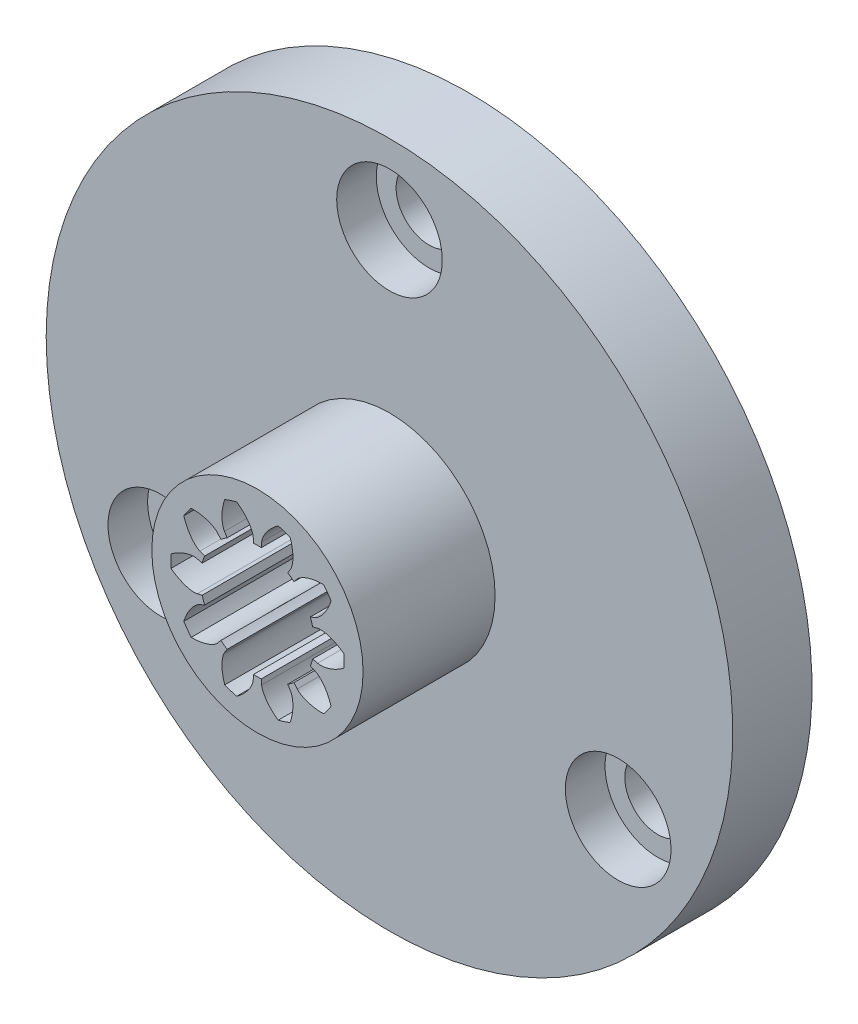
from build123d import *

# Parameters (mm, degrees)
SKETCH_1_R               = 4
SKETCH_1_R_2             = 2.15625
EXTRUDE_1_DEPTH          = 5
CUT_EXTRUDE_2_DEPTH      = 8.549834435
PATTERN_CIRCULAR_1_COUNT = 10
SKETCH_2_R               = 13
SKETCH_2_R_2             = 1.6
EXTRUDE_2_DEPTH          = 3
SKETCH_2_3_R             = 1.25
CUT_EXTRUDE_4_DEPTH      = 20.05255891
SKETCH_2_4_R             = 2
CUT_EXTRUDE_5_DEPTH      = 1.5
PATTERN_CIRCULAR_2_COUNT = 3
SKETCH_3_R               = 2.55
CUT_EXTRUDE_6_DEPTH      = 2.6


with BuildPart() as part:
    # 草图1 → 凸台-拉伸1 (new body)
    with BuildSketch(Plane.XY):
        Circle(SKETCH_1_R)
        Circle(SKETCH_1_R_2, mode=Mode.SUBTRACT)
    extrude(amount=EXTRUDE_1_DEPTH)

    # 草图1<3> → 切除-拉伸2 (cut, through all)
    with BuildSketch(Plane.XY):
        with BuildLine():
            Line((2.278429817, 0.5724041), (2.091264392, 0.525383009))
            ThreePointArc((2.091264392, 0.525383009), (2.139941928, 0.264693424), (2.15625, 0))
            ThreePointArc((2.15625, 0), (2.139941928, -0.264693424), (2.091264392, -0.525383009))
            Line((2.091264392, -0.525383009), (2.278429817, -0.5724041))
            add(Edge.make_bspline(
                [(2.278429817, -0.5724041), (2.295797672, -0.576767382), (2.345172398, -0.585334167), (2.441262866, -0.586832058), (2.595840027, -0.567867592), (2.790275289, -0.512384646), (2.990744635, -0.422850474), (3.139651401, -0.33303644), (3.232663442, -0.267579154), (3.272632903, -0.237645626)],
                knots=[0, 0, 0, 0, 0, 0.005604068, 0.015718248, 0.029959916, 0.048733667, 0.068727063, 0.084389094, 0.084389094, 0.084389094, 0.084389094, 0.084389094], degree=4))
            ThreePointArc((3.272632903, -0.237645626), (3.279095018, -0.118900902), (3.28125, 0))
            ThreePointArc((3.28125, 0), (3.279095018, 0.118900902), (3.272632903, 0.237645626))
            add(Edge.make_bspline(
                [(2.278429817, 0.5724041), (2.295797672, 0.576767382), (2.345172398, 0.585334167), (2.441262866, 0.586832058), (2.595840027, 0.567867592), (2.790275289, 0.512384646), (2.990744635, 0.422850474), (3.139651401, 0.33303644), (3.232663442, 0.267579154), (3.272632903, 0.237645626)],
                knots=[0, 0, 0, 0, 0, 0.005604068, 0.015718248, 0.029959916, 0.048733667, 0.068727063, 0.084389094, 0.084389094, 0.084389094, 0.084389094, 0.084389094], degree=4))
        make_face()
    cut_extrude_2 = extrude(amount=CUT_EXTRUDE_2_DEPTH, mode=Mode.SUBTRACT)

    # 阵列(圆周)1: 切除-拉伸2 ×10 about axis
    pattern_circular_1_axis = Axis((0, 0, 5), (0, 0, 1))
    for i in range(1, PATTERN_CIRCULAR_1_COUNT):
        add(cut_extrude_2.rotate(pattern_circular_1_axis, i * 360 / PATTERN_CIRCULAR_1_COUNT), mode=Mode.SUBTRACT)

    # 草图2 → 凸台-拉伸2 (add)
    with BuildSketch(Plane(origin=(0, 0, 0), x_dir=(-1, 0, 0), z_dir=(0, 0, -1))):
        Circle(SKETCH_2_R)
        Circle(SKETCH_2_R_2, mode=Mode.SUBTRACT)
    extrude(amount=EXTRUDE_2_DEPTH)

    # 草图2<3> → 切除-拉伸4 (cut, through all)
    with BuildSketch(Plane(origin=(0, 0, 0), x_dir=(-1, 0, 0), z_dir=(0, 0, -1))):
        with Locations((0, 10)):
            Circle(SKETCH_2_3_R)
    cut_extrude_4 = extrude(amount=CUT_EXTRUDE_4_DEPTH, mode=Mode.SUBTRACT)

    # 草图2<4> → 切除-拉伸5 (cut)
    with BuildSketch(Plane(origin=(0, 0, 0), x_dir=(-1, 0, 0), z_dir=(0, 0, -1))):
        with Locations((0, 10)):
            Circle(SKETCH_2_4_R)
    cut_extrude_5 = extrude(amount=CUT_EXTRUDE_5_DEPTH, mode=Mode.SUBTRACT)

    # 阵列(圆周)2: 切除-拉伸4, 切除-拉伸5 ×3 about axis
    pattern_circular_2_axis = Axis((0, 0, 0), (0, 0, 1))
    add([cut_extrude_4.rotate(pattern_circular_2_axis, i * 360 / PATTERN_CIRCULAR_2_COUNT) for i in range(1, PATTERN_CIRCULAR_2_COUNT)], mode=Mode.SUBTRACT)
    add([cut_extrude_5.rotate(pattern_circular_2_axis, i * 360 / PATTERN_CIRCULAR_2_COUNT) for i in range(1, PATTERN_CIRCULAR_2_COUNT)], mode=Mode.SUBTRACT)

    # 草图3 → 切除-拉伸6 (cut)
    with BuildSketch(Plane(origin=(0, 0, -3), x_dir=(-1, 0, 0), z_dir=(0, 0, -1))):
        Circle(SKETCH_3_R)
    extrude(amount=-CUT_EXTRUDE_6_DEPTH, mode=Mode.SUBTRACT)


solid = part.part
